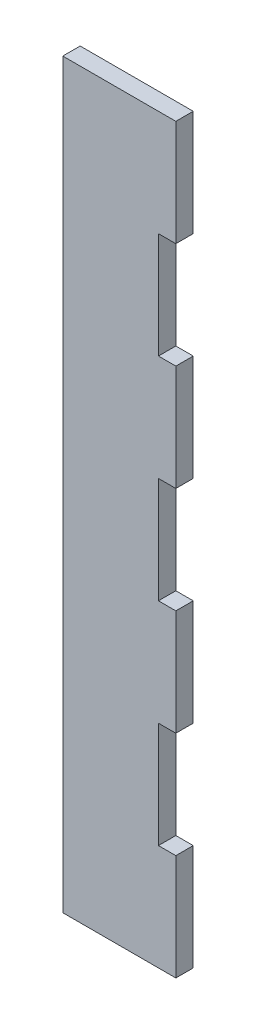
from build123d import *

# Parameters (mm, degrees)
SKETCH1_W           = 6.35
SKETCH1_H           = 203.2
SKETCH1_W_2         = 4.7625
SKETCH1_H_2         = 29.028571429
BOSS_EXTRUDE1_DEPTH = 4.7625
SKETCH2_W           = 4.7625
SKETCH2_H           = 203.2
BOSS_EXTRUDE2_DEPTH = 13.5


with BuildPart() as part:
    # Sketch1 → Boss-Extrude1 (new body)
    with BuildSketch(Plane.XY):
        with Locations((-3.175, 0)):
            Rectangle(SKETCH1_W, SKETCH1_H)
        Polygon((6.35, 101.6), (0, 101.6), (0, -101.6), (6.35, -101.6), (6.35, -72.571428571), (6.35, -43.542857143), (6.35, -14.514285714), (6.35, 14.514285714), (6.35, 43.542857143), (6.35, 72.571428571), align=None)
        with Locations((8.73125, 87.085714286)):
            Rectangle(SKETCH1_W_2, SKETCH1_H_2)
        with Locations((8.73125, 29.028571429)):
            Rectangle(SKETCH1_W_2, SKETCH1_H_2)
        with Locations((8.73125, -29.028571429)):
            Rectangle(SKETCH1_W_2, SKETCH1_H_2)
        with Locations((8.73125, -87.085714286)):
            Rectangle(SKETCH1_W_2, SKETCH1_H_2)
    extrude(amount=BOSS_EXTRUDE1_DEPTH)

    # Sketch2 → Boss-Extrude2 (add)
    with BuildSketch(Plane.ZY.offset(6.35)):
        with Locations((2.38125, 0)):
            Rectangle(SKETCH2_W, SKETCH2_H)
    extrude(amount=BOSS_EXTRUDE2_DEPTH)


solid = part.part
